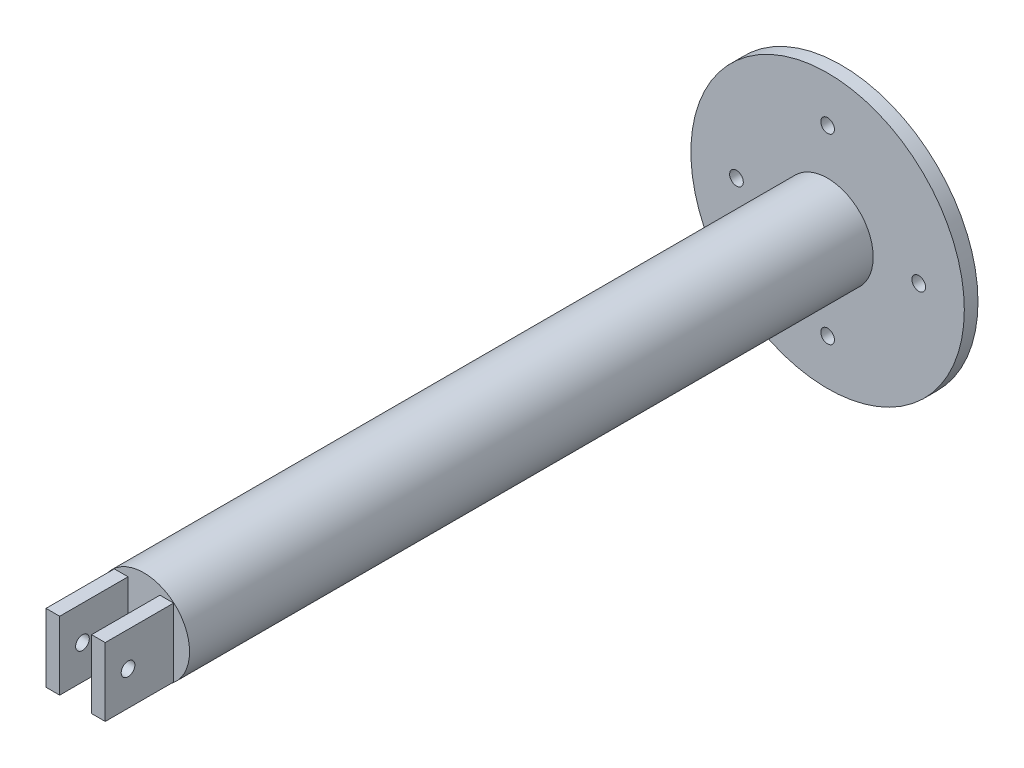
from build123d import *

# Parameters (mm, degrees)
SKETCH_1_R          = 30
SKETCH_1_R_2        = 1.5
EXTRUDE_1_DEPTH     = 3
SKETCH_3_R          = 10
EXTRUDE_3_DEPTH     = 150
SKETCH_4_W          = 3
SKETCH_4_H          = 15
EXTRUDE_4_DEPTH     = 15
SKETCH_5_R          = 1.5
CUT_EXTRUDE_1_DEPTH = 175.51719113


with BuildPart() as part:
    # Эскиз1 → Бобышка-Вытянуть1 (new body)
    with BuildSketch(Plane.XY):
        Circle(SKETCH_1_R)
        with Locations((-20, 0)):
            Circle(SKETCH_1_R_2, mode=Mode.SUBTRACT)
        with Locations((0, -20)):
            Circle(SKETCH_1_R_2, mode=Mode.SUBTRACT)
        with Locations((20, 0)):
            Circle(SKETCH_1_R_2, mode=Mode.SUBTRACT)
        with Locations((0, 20)):
            Circle(SKETCH_1_R_2, mode=Mode.SUBTRACT)
    extrude(amount=EXTRUDE_1_DEPTH)

    # Эскиз3 → Бобышка-Вытянуть3 (add)
    with BuildSketch(Plane.XY.offset(3)):
        Circle(SKETCH_3_R)
    extrude(amount=EXTRUDE_3_DEPTH)

    # Эскиз4 → Бобышка-Вытянуть4 (add)
    with BuildSketch(Plane.XY.offset(153)):
        with Locations((-5, 0)):
            Rectangle(SKETCH_4_W, SKETCH_4_H)
        with Locations((5, 0)):
            Rectangle(SKETCH_4_W, SKETCH_4_H)
    extrude(amount=EXTRUDE_4_DEPTH)

    # Эскиз5 → Вырез-Вытянуть1 (cut, through all)
    with BuildSketch(Plane(origin=(6.5, 0, 0), x_dir=(0, 0, -1), z_dir=(1, 0, 0))):
        with Locations((-163, 0)):
            Circle(SKETCH_5_R)
    extrude(amount=-CUT_EXTRUDE_1_DEPTH, mode=Mode.SUBTRACT)


solid = part.part
